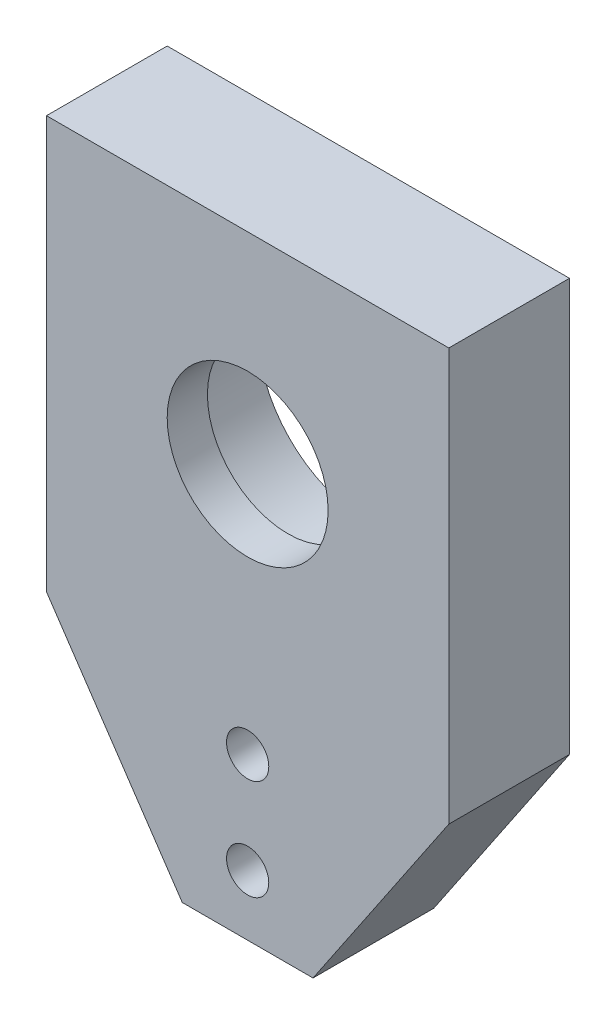
from build123d import *

# Parameters (mm, degrees)
SKETCH1_R           = 11
SKETCH1_R_2         = 2.1
BOSS_EXTRUDE1_DEPTH = 8
SKETCH2_R           = 8
SKETCH2_R_2         = 2.1
BOSS_EXTRUDE2_DEPTH = 4


with BuildPart() as part:
    # Sketch1 → Boss-Extrude1 (new body)
    with BuildSketch(Plane.XY):
        Polygon((-20, 20), (20, 20), (20, -21), (6.5, -41), (-6.5, -41), (-20, -21), align=None)
        Circle(SKETCH1_R, mode=Mode.SUBTRACT)
        with Locations((0, -35)):
            Circle(SKETCH1_R_2, mode=Mode.SUBTRACT)
        with Locations((0, -25)):
            Circle(SKETCH1_R_2, mode=Mode.SUBTRACT)
    extrude(amount=BOSS_EXTRUDE1_DEPTH)

    # Sketch2 → Boss-Extrude2 (add)
    with BuildSketch(Plane.XY.offset(8)):
        Polygon((20, -21), (20, 20), (-20, 20), (-20, -21), (-6.5, -41), (6.5, -41), align=None)
        Circle(SKETCH2_R, mode=Mode.SUBTRACT)
        with Locations((0, -35)):
            Circle(SKETCH2_R_2, mode=Mode.SUBTRACT)
        with Locations((0, -25)):
            Circle(SKETCH2_R_2, mode=Mode.SUBTRACT)
    extrude(amount=BOSS_EXTRUDE2_DEPTH)


solid = part.part
